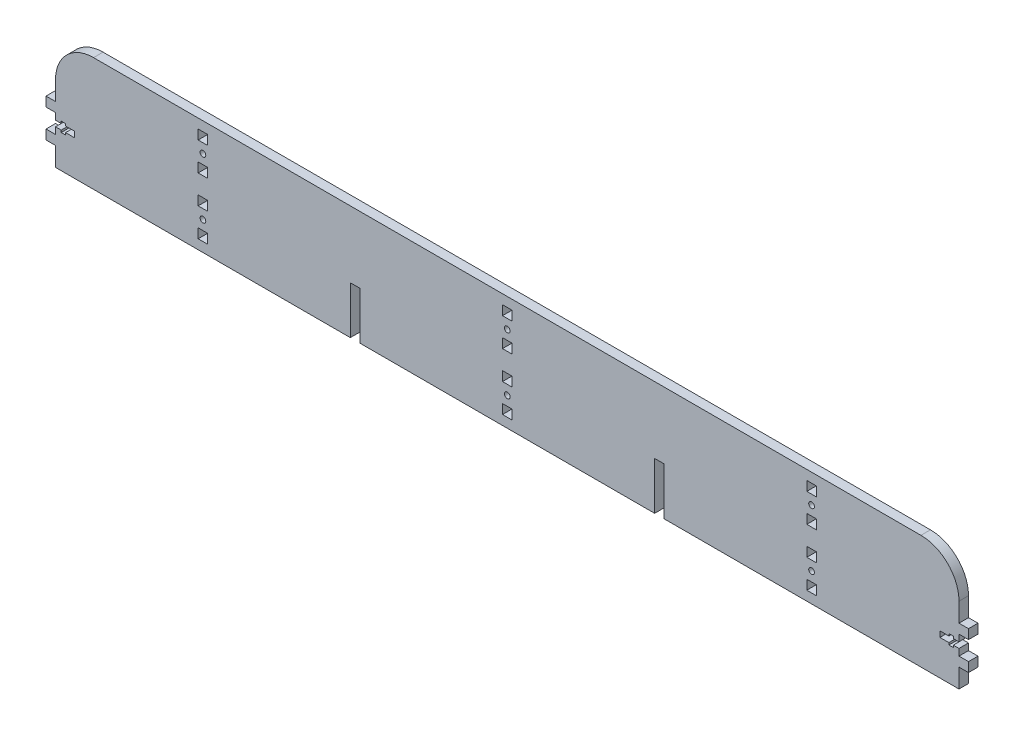
from build123d import *

# Parameters (mm, degrees)
ESQUISSE1_R        = 1.5
ESQUISSE1_W        = 5
ESQUISSE1_H        = 5
BOSS_EXTRU_1_DEPTH = 5
CONG_1_R           = 20


with BuildPart() as part:
    # Esquisse1 → Boss.-Extru.1 (new body)
    with BuildSketch(Plane.XY):
        Polygon((0, 21.5), (0, 25), (-5, 25), (-5, 30), (0, 30), (0, 60), (475, 60), (475, 30), (480, 30), (480, 25), (475, 25), (475, 21.5), (472, 21.5), (472, 22.6), (469.7, 22.6), (469.7, 21.5), (465, 21.5), (465, 18.5), (469.7, 18.5), (469.7, 17.4), (472, 17.4), (472, 18.5), (475, 18.5), (475, 15), (480, 15), (480, 10), (475, 10), (475, 0), (320, 0), (320, 25), (315, 25), (315, 0), (160, 0), (160, 25), (155, 25), (155, 0), (0, 0), (0, 10), (-5, 10), (-5, 15), (0, 15), (0, 18.5), (3, 18.5), (3, 17.4), (5.3, 17.4), (5.3, 18.5), (10, 18.5), (10, 21.5), (5.3, 21.5), (5.3, 22.6), (3, 22.6), (3, 21.5), align=None)
        with Locations((397.5, 15)):
            Circle(ESQUISSE1_R, mode=Mode.SUBTRACT)
        with Locations((397.5, 45)):
            Circle(ESQUISSE1_R, mode=Mode.SUBTRACT)
        with Locations((237.5, 15)):
            Circle(ESQUISSE1_R, mode=Mode.SUBTRACT)
        with Locations((237.5, 45)):
            Circle(ESQUISSE1_R, mode=Mode.SUBTRACT)
        with Locations((77.5, 15)):
            Circle(ESQUISSE1_R, mode=Mode.SUBTRACT)
        with Locations((77.5, 45)):
            Circle(ESQUISSE1_R, mode=Mode.SUBTRACT)
        with Locations((397.5, 7.5)):
            Rectangle(ESQUISSE1_W, ESQUISSE1_H, mode=Mode.SUBTRACT)
        with Locations((397.5, 22.5)):
            Rectangle(ESQUISSE1_W, ESQUISSE1_H, mode=Mode.SUBTRACT)
        with Locations((397.5, 37.5)):
            Rectangle(ESQUISSE1_W, ESQUISSE1_H, mode=Mode.SUBTRACT)
        with Locations((397.5, 52.5)):
            Rectangle(ESQUISSE1_W, ESQUISSE1_H, mode=Mode.SUBTRACT)
        with Locations((237.5, 7.5)):
            Rectangle(ESQUISSE1_W, ESQUISSE1_H, mode=Mode.SUBTRACT)
        with Locations((237.5, 22.5)):
            Rectangle(ESQUISSE1_W, ESQUISSE1_H, mode=Mode.SUBTRACT)
        with Locations((237.5, 37.5)):
            Rectangle(ESQUISSE1_W, ESQUISSE1_H, mode=Mode.SUBTRACT)
        with Locations((237.5, 52.5)):
            Rectangle(ESQUISSE1_W, ESQUISSE1_H, mode=Mode.SUBTRACT)
        with Locations((77.5, 7.5)):
            Rectangle(ESQUISSE1_W, ESQUISSE1_H, mode=Mode.SUBTRACT)
        with Locations((77.5, 22.5)):
            Rectangle(ESQUISSE1_W, ESQUISSE1_H, mode=Mode.SUBTRACT)
        with Locations((77.5, 37.5)):
            Rectangle(ESQUISSE1_W, ESQUISSE1_H, mode=Mode.SUBTRACT)
        with Locations((77.5, 52.5)):
            Rectangle(ESQUISSE1_W, ESQUISSE1_H, mode=Mode.SUBTRACT)
    extrude(amount=BOSS_EXTRU_1_DEPTH)

    # Congé1
    cong_1_edges = [part.edges().sort_by_distance(p)[0] for p in [
        (0, 60, 2.5),
        (475, 60, 2.5),
    ]]
    fillet(cong_1_edges, radius=CONG_1_R)


solid = part.part
